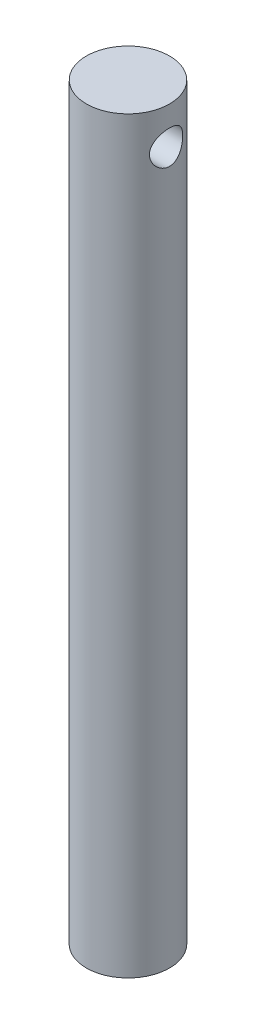
from build123d import *

# Parameters (mm, degrees)
SKETCH1_R               = 10
BOSS_EXTRUDE1_DEPTH     = 180
CUT_EXTRUDE1_DEPTH      = 181.554700853
CUT_EXTRUDE1_DEPTH_BACK = 181.554700853
SKETCH2_R               = 4


with BuildPart() as part:
    # Sketch1 → Boss-Extrude1 (new body)
    with BuildSketch(Plane(origin=(0, 0, 0), x_dir=(1, 0, 0), z_dir=(0, 1, 0))):
        with Locations(Location((0, 0, 0), (0, 0, 90))):
            Circle(SKETCH1_R)
    extrude(amount=BOSS_EXTRUDE1_DEPTH)

    # Sketch2 → Cut-Extrude1 (cut, two sides: drawn at the far end of the back side and taken through both)
    with BuildSketch(Plane(origin=(0, 0, 0), x_dir=(0, 0, -1), z_dir=(1, 0, 0)).offset(-CUT_EXTRUDE1_DEPTH_BACK)):
        with Locations((0, 171)):
            Circle(SKETCH2_R)
    extrude(amount=CUT_EXTRUDE1_DEPTH + CUT_EXTRUDE1_DEPTH_BACK, mode=Mode.SUBTRACT)


solid = part.part
